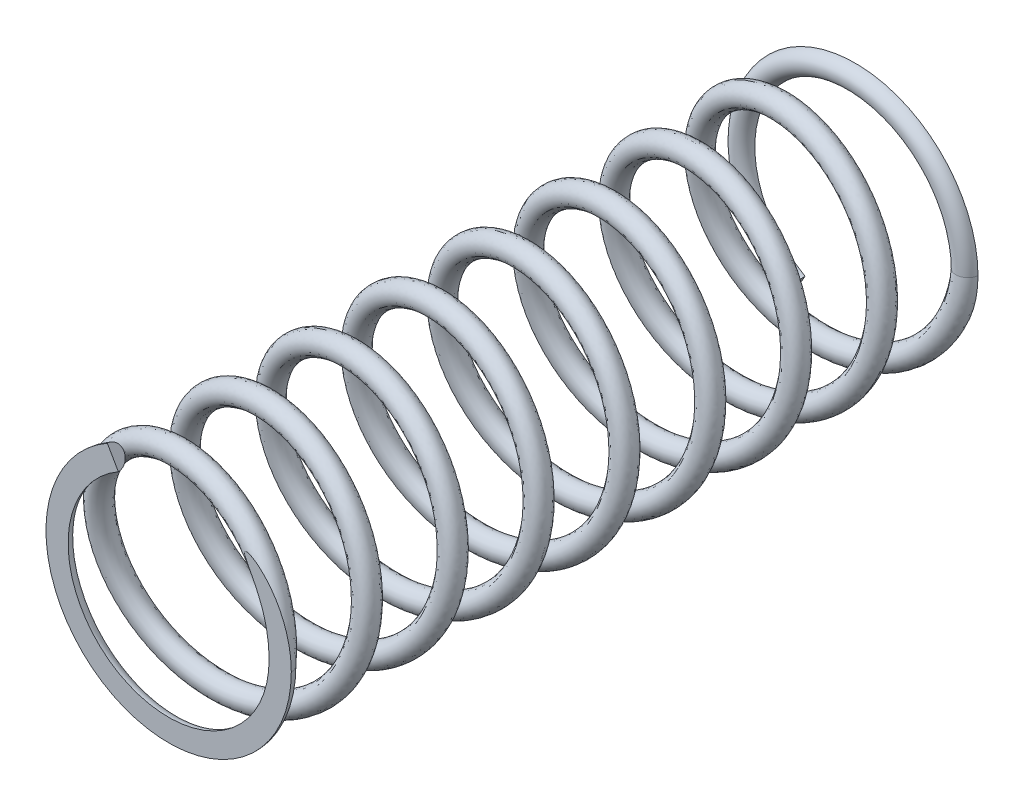
from build123d import *

# Parameters (mm, degrees)
SWEEP1_PITCH       = 15.5
SWEEP1_HEIGHT      = 124
SWEEP1_RADIUS      = 20.15
SWEEP1_PROFILE_R   = 2
SWEEP2_PROFILE_R   = 2
SKETCH41_R         = 25
CUT_EXTRUDE1_DEPTH = 130.821069659
SWEEP3_PROFILE_R   = 2
SKETCH55_R         = 25
CUT_EXTRUDE2_DEPTH = 130.821069659


with BuildPart() as part:
    # Sweep1: sweep along a helix
    with BuildLine() as sweep1_path:
        Helix(SWEEP1_PITCH, SWEEP1_HEIGHT, SWEEP1_RADIUS, center=(0, 0, 0), direction=(0, 0, 1), lefthand=True)
    # Sweep1 profile (on start of the path) → Sweep1 (sweep)
    with BuildSketch(Plane(origin=(20.15, 0, 0), x_dir=(0, -0.12151957796954639, -0.9925890348830695), z_dir=(1.756342560688661e-13, -0.9925890348830695, 0.12151957796954639))):
        Circle(SWEEP1_PROFILE_R)
    sweep(path=sweep1_path.line, is_frenet=True)

    # Sweep2: sweep along a path in Sketch10
    with BuildLine(Plane.XY.offset(124)) as sweep2_path:
        ThreePointArc((20.15, 0), (-10.075, -17.450411886), (-10.075, 17.450411886))
    # Sweep2 profile (on start of the path) → Sweep2 (sweep)
    with BuildSketch(Plane(origin=(20.15, 0, 124), x_dir=(-1, 0, 0), z_dir=(0, -1, 0))):
        Circle(SWEEP2_PROFILE_R)
    sweep(path=sweep2_path.line)

    # Sketch41 → Cut-Extrude1 (cut, through all)
    with BuildSketch(Plane.XY.offset(124)):
        Circle(SKETCH41_R)
    extrude(amount=CUT_EXTRUDE1_DEPTH, mode=Mode.SUBTRACT)

    # Sweep3: sweep along a path in Sketch42
    with BuildLine(Plane.XY) as sweep3_path:
        ThreePointArc((20.15, 0), (-10.075, 17.450411886), (-10.075, -17.450411886))
    # Sweep3 profile (on start of the path) → Sweep3 (sweep)
    with BuildSketch(Plane(origin=(20.15, 0, 0), x_dir=(1, 0, 0), z_dir=(0, 1, 0))):
        Circle(SWEEP3_PROFILE_R)
    sweep(path=sweep3_path.line)

    # Sketch55 → Cut-Extrude2 (cut, through all)
    with BuildSketch(Plane.XY):
        Circle(SKETCH55_R)
    extrude(amount=-CUT_EXTRUDE2_DEPTH, mode=Mode.SUBTRACT)


solid = part.part
